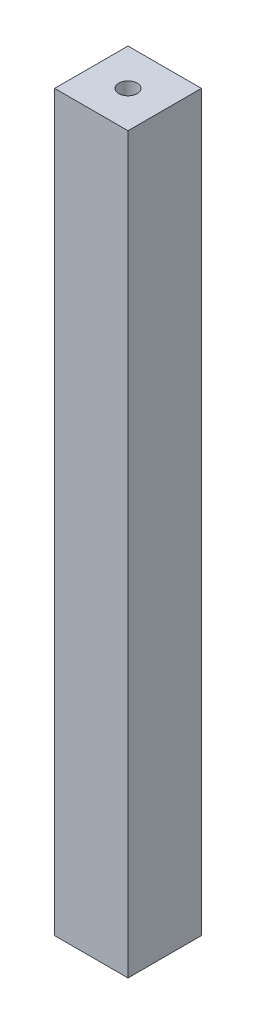
from build123d import *

# Parameters (mm, degrees)
SKETCH1_W           = 20
SKETCH1_H           = 20
BOSS_EXTRUDE1_DEPTH = 200
SKETCH2_R           = 2.5
CUT_EXTRUDE1_DEPTH  = 150


with BuildPart() as part:
    # Sketch1 → Boss-Extrude1 (new body)
    with BuildSketch(Plane(origin=(0, 0, 0), x_dir=(1, 0, 0), z_dir=(0, 1, 0))):
        Rectangle(SKETCH1_W, SKETCH1_H)
    extrude(amount=BOSS_EXTRUDE1_DEPTH)

    # Sketch2 → Cut-Extrude1 (cut)
    with BuildSketch(Plane(origin=(0, 200, 0), x_dir=(1, 0, 0), z_dir=(0, 1, 0))):
        with Locations(Location((0, 0, 0), (0, 0, 270))):
            Circle(SKETCH2_R)
    extrude(amount=-CUT_EXTRUDE1_DEPTH, mode=Mode.SUBTRACT)


solid = part.part
